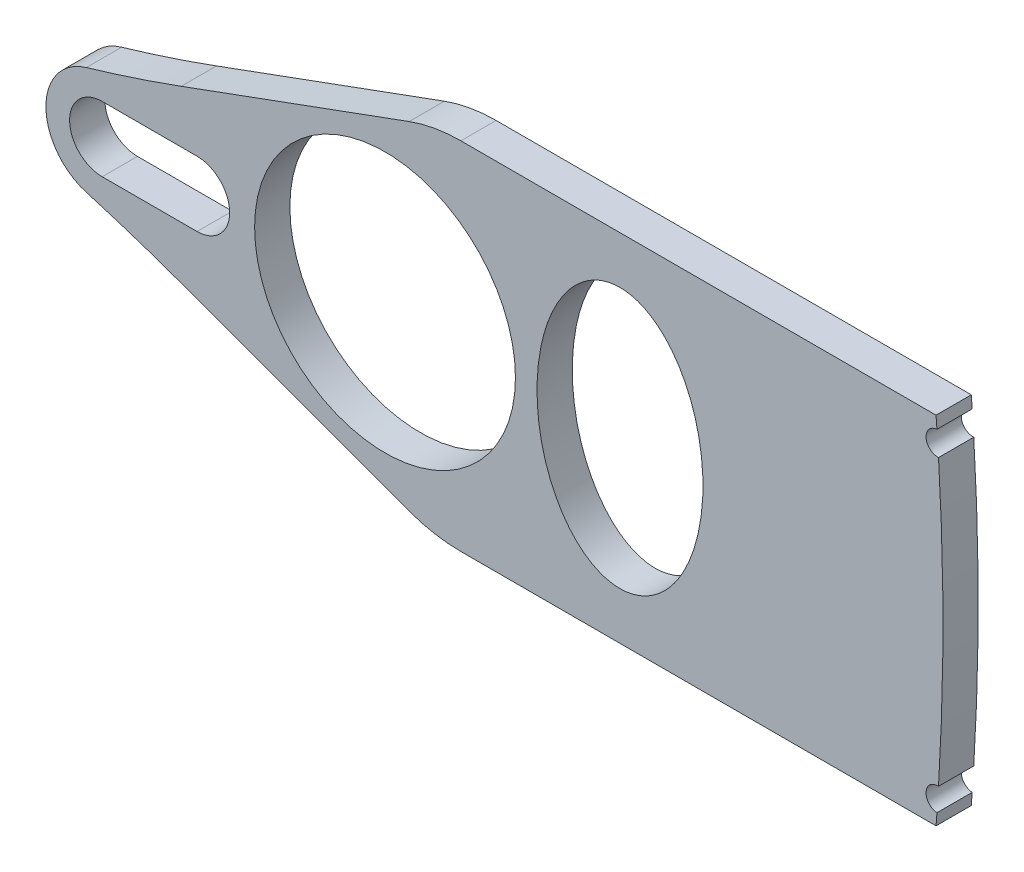
from build123d import *

# Parameters (mm, degrees)
SKETCH1_R           = 11.1010859
SKETCH1_RX          = 11.1010859
SKETCH1_RY          = 7.064327391
BOSS_EXTRUDE1_DEPTH = 3


with BuildPart() as part:
    # Sketch1 → Boss-Extrude1 (new body)
    with BuildSketch(Plane.XY):
        with BuildLine():
            Line((28.826197236, 15.137844409), (5.91044133, 15.137844409))
            ThreePointArc((5.91044133, 15.137844409), (3.673142738, 14.941061094), (1.504545567, 14.356753838))
            Line((1.504545567, 14.356753838), (-17.894214973, 7.255421854))
            ThreePointArc((-17.894214973, 7.255421854), (-21.907637047, 5.861214166), (-25.965065064, 4.60079768))
            ThreePointArc((-25.965065064, 4.60079768), (-29.412703897, 0), (-25.965065064, -4.60079768))
            ThreePointArc((-25.965065064, -4.60079768), (-21.907637047, -5.861214166), (-17.894214973, -7.255421854))
            Line((-17.894214973, -7.255421854), (1.504545567, -14.356753838))
            ThreePointArc((1.504545567, -14.356753838), (3.673142738, -14.941061094), (5.91044133, -15.137844409))
            Line((5.91044133, -15.137844409), (28.826197236, -15.137844409))
            Line((28.826197236, -15.137844409), (46.358712744, -15.137844409))
            ThreePointArc((46.358712744, -15.137844409), (46.397106085, -14.634708554), (46.434201657, -14.131475353))
            ThreePointArc((46.434201657, -14.131475353), (45.709460852, -13.733597625), (45.525288247, -12.927597395))
            ThreePointArc((45.525288247, -12.927597395), (45.896463104, -12.328004553), (46.569590651, -12.117810222))
            ThreePointArc((46.569590651, -12.117810222), (46.945219405, 0), (46.569590651, 12.117810222))
            ThreePointArc((46.569590651, 12.117810222), (45.752067528, 12.464773232), (45.525288247, 13.323434133))
            ThreePointArc((45.525288247, 13.323434133), (45.844356214, 13.879744795), (46.434201657, 14.131475353))
            ThreePointArc((46.434201657, 14.131475353), (46.397106085, 14.634708554), (46.358712744, 15.137844409))
            Line((46.358712744, 15.137844409), (28.826197236, 15.137844409))
        make_face()
        with Locations((-0.54553615, 0)):
            Circle(SKETCH1_R, mode=Mode.SUBTRACT)
        with Locations(Location((19.45446385, 0), (0, 0, -90))):
            Ellipse(SKETCH1_RX, SKETCH1_RY, mode=Mode.SUBTRACT)
        with BuildLine():
            Line((-16.54553615, -2.775271475), (-24.619053168, -2.775271475))
            ThreePointArc((-24.619053168, -2.775271475), (-27.394324643, 0), (-24.619053168, 2.775271475))
            Line((-24.619053168, 2.775271475), (-16.54553615, 2.775271475))
            ThreePointArc((-16.54553615, 2.775271475), (-13.770264675, 0), (-16.54553615, -2.775271475))
        make_face(mode=Mode.SUBTRACT)
    extrude(amount=BOSS_EXTRUDE1_DEPTH)


solid = part.part
